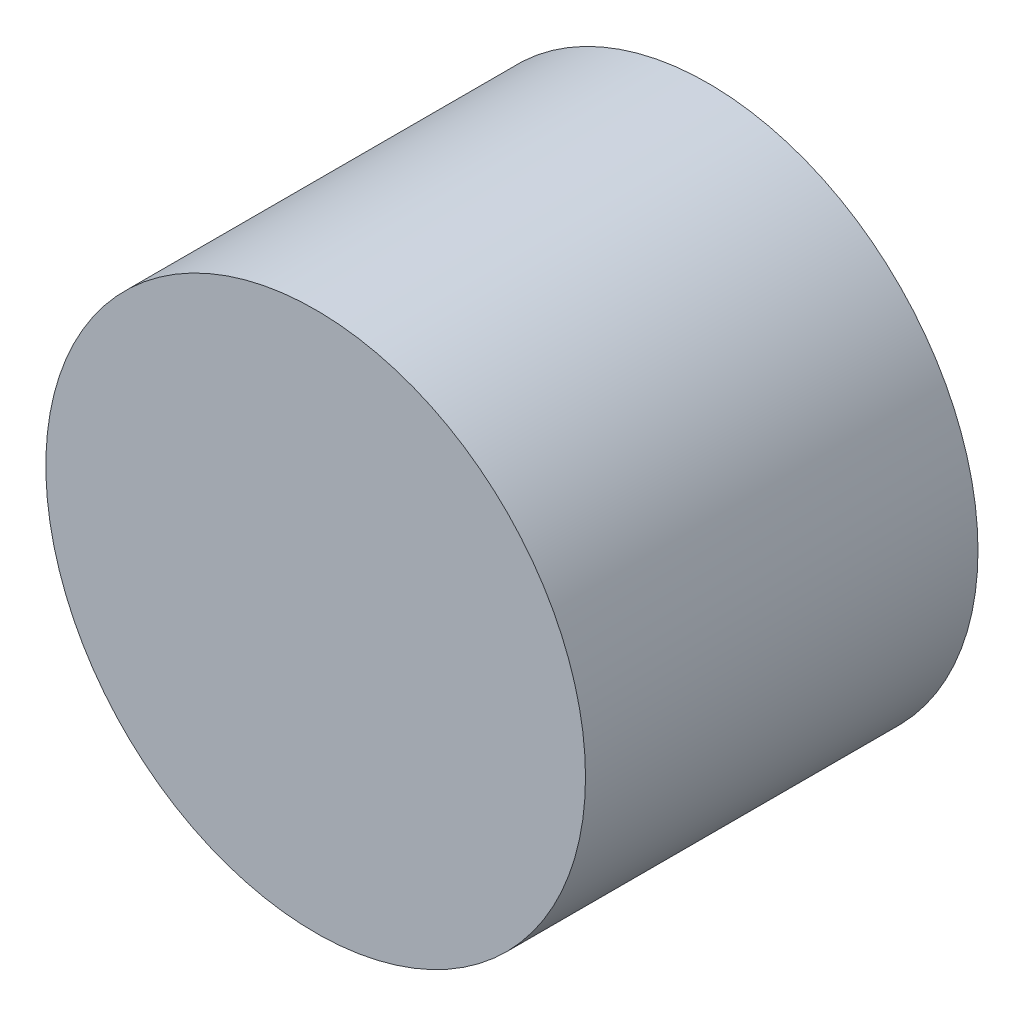
from build123d import *

# Parameters (mm, degrees)
SKETCH_1_R      = 5.5
EXTRUDE_1_DEPTH = 8


with BuildPart() as part:
    # 草图1 → 凸台-拉伸1 (new body)
    with BuildSketch(Plane.XY):
        Circle(SKETCH_1_R)
    extrude(amount=EXTRUDE_1_DEPTH)


solid = part.part
